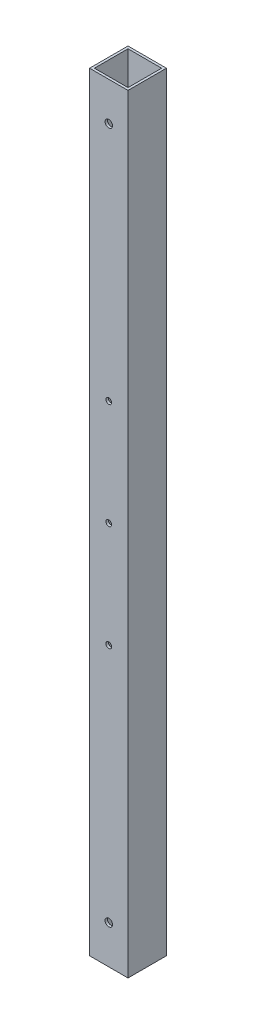
from build123d import *

# Parameters (mm, degrees)
SKETCH1_W                        = 25.4
SKETCH1_H                        = 25.4
SKETCH1_W_2                      = 22.225
SKETCH1_H_2                      = 22.225
BOSS_EXTRUDE1_DEPTH              = 254
F_10_0_1935_DIAMETER_HOLE1_D     = 4.9149
F_10_0_1935_DIAMETER_HOLE1_DEPTH = 50.8
F_10_0_1935_DIAMETER_HOLE1_TIP   = 1.476584928
SKETCH6_R                        = 1.905
CUT_EXTRUDE1_DEPTH               = 256.582569828


with BuildPart() as part:
    # Sketch1 → Boss-Extrude1 (new, symmetric)
    with BuildSketch(Plane(origin=(0, 0, 0), x_dir=(1, 0, 0), z_dir=(0, 1, 0))):
        Rectangle(SKETCH1_W, SKETCH1_H)
        Rectangle(SKETCH1_W_2, SKETCH1_H_2, mode=Mode.SUBTRACT)
    extrude(amount=BOSS_EXTRUDE1_DEPTH, both=True)

    # #10 (0.1935) Diameter Hole1
    with Locations(Plane(origin=(0, 0, -12.7), x_dir=(-1, 0, 0), z_dir=(0, 0, -1))):
        with Locations((0, 228.6), (0, -228.6)):
            Hole(F_10_0_1935_DIAMETER_HOLE1_D / 2, depth=F_10_0_1935_DIAMETER_HOLE1_DEPTH)
            with Locations((0, 0, -(F_10_0_1935_DIAMETER_HOLE1_DEPTH + F_10_0_1935_DIAMETER_HOLE1_TIP / 2))):  # 118° drill point
                Cone(0, F_10_0_1935_DIAMETER_HOLE1_D / 2, F_10_0_1935_DIAMETER_HOLE1_TIP, mode=Mode.SUBTRACT)

    # Sketch6 → Cut-Extrude1 (cut, through all)
    with BuildSketch(Plane.XY.offset(12.7)):
        with Locations((0, -69.85)):
            Circle(SKETCH6_R)
        Circle(SKETCH6_R)
        with Locations((0, 69.85)):
            Circle(SKETCH6_R)
    extrude(amount=-CUT_EXTRUDE1_DEPTH, mode=Mode.SUBTRACT)


solid = part.part
